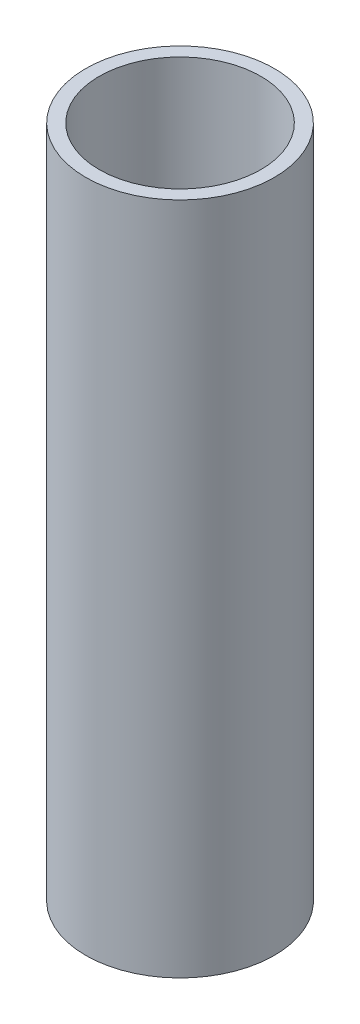
from build123d import *

# Parameters (mm, degrees)
SKETCH1_R           = 7
SKETCH1_R_2         = 6
BOSS_EXTRUDE1_DEPTH = 50


with BuildPart() as part:
    # Sketch1 → Boss-Extrude1 (new body)
    with BuildSketch(Plane(origin=(0, 0, 0), x_dir=(1, 0, 0), z_dir=(0, 1, 0))):
        with Locations(Location((0, 0, 0), (0, 0, 270))):
            Circle(SKETCH1_R)
        with Locations(Location((0, 0, 0), (0, 0, 270))):
            Circle(SKETCH1_R_2, mode=Mode.SUBTRACT)
    extrude(amount=BOSS_EXTRUDE1_DEPTH)


solid = part.part
